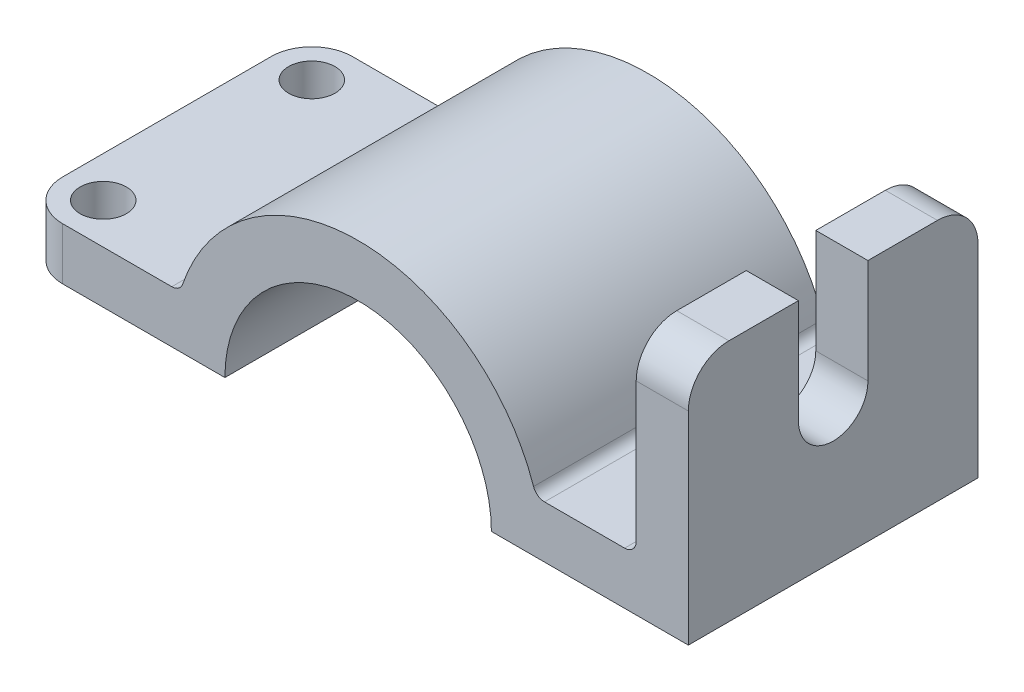
from build123d import *

# Parameters (mm, degrees)
BOSS_EXTRUDE1_DEPTH = 25
CUT_EXTRUDE1_DEPTH  = 9
FILLET1_R           = 7
SKETCH4_R           = 4
CUT_EXTRUDE2_DEPTH  = 9


with BuildPart() as part:
    # Sketch2 → Boss-Extrude1 (new, symmetric)
    with BuildSketch(Plane.XY):
        with BuildLine():
            Line((23, 0), (57, 0))
            Line((57, 0), (57, 42))
            Line((57, 42), (48, 42))
            Line((48, 42), (48, 11))
            ThreePointArc((48, 11), (47.414213562, 9.585786438), (46, 9))
            Line((46, 9), (32.171415884, 9))
            ThreePointArc((32.171415884, 9), (31.008255888, 9.373021566), (30.278979656, 10.352941176))
            ThreePointArc((30.278979656, 10.352941176), (0, 32), (-30.278979656, 10.352941176))
            ThreePointArc((-30.278979656, 10.352941176), (-31.008255888, 9.373021566), (-32.171415884, 9))
            Line((-32.171415884, 9), (-58, 9))
            Line((-58, 9), (-58, 0))
            Line((-58, 0), (-23, 0))
            ThreePointArc((-23, 0), (0, 23), (23, 0))
        make_face()
    extrude(amount=BOSS_EXTRUDE1_DEPTH, both=True)

    # Sketch3 → Cut-Extrude1 (cut)
    with BuildSketch(Plane(origin=(57, 0, 0), x_dir=(0, 0, -1), z_dir=(1, 0, 0))):
        with BuildLine():
            Line((-6, 24), (-6, 42))
            Line((-6, 42), (6, 42))
            Line((6, 42), (6, 24))
            ThreePointArc((6, 24), (0, 18), (-6, 24))
        make_face()
    extrude(amount=-CUT_EXTRUDE1_DEPTH, mode=Mode.SUBTRACT)

    # Fillet1
    fillet1_edges = [part.edges().sort_by_distance(p)[0] for p in [
        (-58, 4.5, -25),
        (52.5, 42, -25),
        (52.5, 42, 25),
        (-58, 4.5, 25),
    ]]
    fillet(fillet1_edges, radius=FILLET1_R)

    # Sketch4 → Cut-Extrude2 (cut)
    with BuildSketch(Plane(origin=(0, 9, 0), x_dir=(1, 0, 0), z_dir=(0, 1, 0))):
        with Locations(Location((-51, 18, 0), (0, 0, 270))):
            Circle(SKETCH4_R)
        with Locations(Location((-51, -18, 0), (0, 0, 270))):
            Circle(SKETCH4_R)
    extrude(amount=-CUT_EXTRUDE2_DEPTH, mode=Mode.SUBTRACT)


solid = part.part
